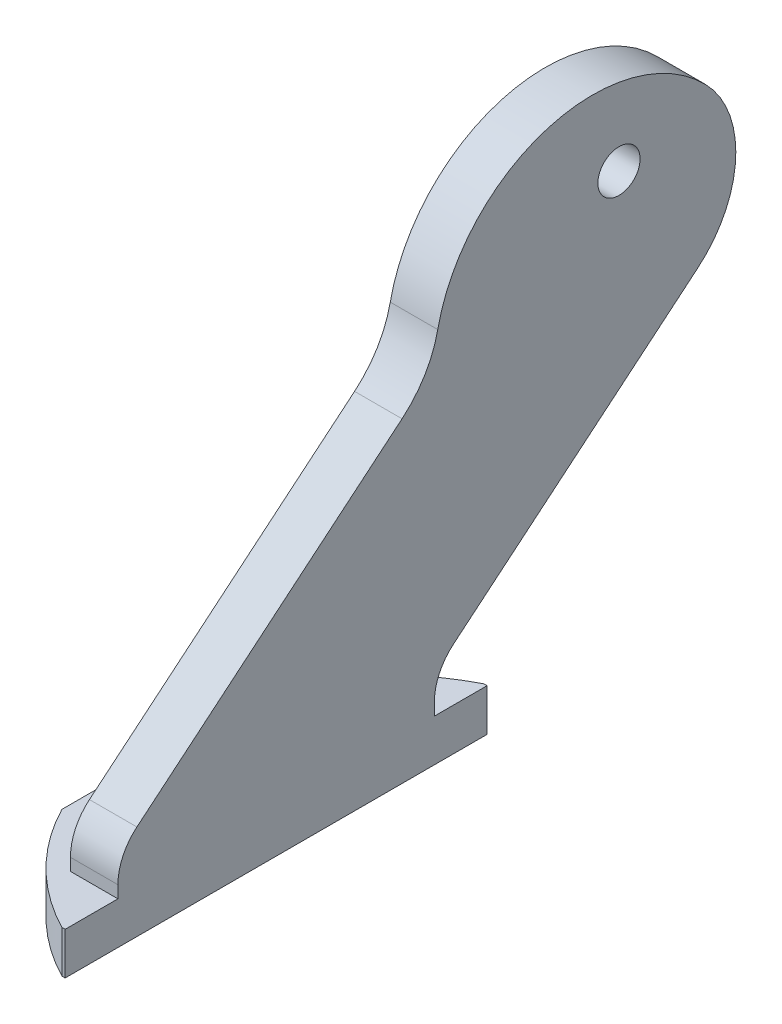
from build123d import *

# Parameters (mm, degrees)
CROQUIS1_W              = 20
CROQUIS1_H              = 80
SALIENTE_EXTRUIR2_DEPTH = 8
CORTAR_EXTRUIR1_DEPTH   = 8
CROQUIS4_R              = 4
SALIENTE_EXTRUIR3_DEPTH = 13
CROQUIS5_W              = 11
CROQUIS5_H              = 133.76595163
CORTAR_EXTRUIR2_DEPTH   = 87
CROQUIS6_R              = 1.6
CORTAR_EXTRUIR3_DEPTH   = 87
CROQUIS7_R              = 3.25
CORTAR_EXTRUIR4_DEPTH   = 3


with BuildPart() as part:
    # Croquis1 → Saliente-Extruir2 (new body)
    with BuildSketch(Plane(origin=(0, 0, 0), x_dir=(1, 0, 0), z_dir=(0, 1, 0))):
        with Locations((-10, 0)):
            Rectangle(CROQUIS1_W, CROQUIS1_H)
    extrude(amount=SALIENTE_EXTRUIR2_DEPTH)

    # Croquis2 → Cortar-Extruir1 (cut)
    with BuildSketch(Plane(origin=(0, 8, 0), x_dir=(1, 0, 0), z_dir=(0, 1, 0))):
        with BuildLine():
            ThreePointArc((-0.615528128, -40), (-11.819805153, -31.819805153), (-20, -20.615528128))
            Line((-20, -20.615528128), (-20, -40))
            Line((-20, -40), (-0.615528128, -40))
        make_face()
        with BuildLine():
            Line((-0.615528128, 40), (-20, 40))
            Line((-20, 40), (-20, 20.615528128))
            ThreePointArc((-20, 20.615528128), (-11.819805153, 31.819805153), (-0.615528128, 40))
        make_face()
    extrude(amount=-CORTAR_EXTRUIR1_DEPTH, mode=Mode.SUBTRACT)

    # Croquis4 → Saliente-Extruir3 (add)
    with BuildSketch(Plane(origin=(0, 0, 0), x_dir=(0, 0, -1), z_dir=(1, 0, 0))):
        with BuildLine():
            Line((0, 0), (30, 0))
            Line((30, 0), (30, 10.31625054))
            ThreePointArc((30, 10.31625054), (30.944105788, 14.557804503), (33.598156003, 17.998463336))
            Line((33.598156003, 17.998463336), (79.953012113, 56.627510094))
            ThreePointArc((79.953012113, 56.627510094), (87.123427128, 70.974483465), (81.447972358, 85.975807058))
            ThreePointArc((81.447972358, 85.975807058), (51.597737237, 93.799339931), (30.637508796, 71.151756681))
            ThreePointArc((30.637508796, 71.151756681), (28.203401142, 64.948074064), (23.866202653, 59.88850221))
            Line((23.866202653, 59.88850221), (-26.401843997, 17.998463336))
            ThreePointArc((-26.401843997, 17.998463336), (-29.055894212, 14.557804503), (-30, 10.31625054))
            Line((-30, 10.31625054), (-30, 0))
            Line((-30, 0), (0, 0))
        make_face()
        with Locations((65, 80)):
            Circle(CROQUIS4_R, mode=Mode.SUBTRACT)
    extrude(amount=-SALIENTE_EXTRUIR3_DEPTH)

    # Croquis5 → Cortar-Extruir2 (cut)
    with BuildSketch(Plane(origin=(0, 95, 0), x_dir=(1, 0, 0), z_dir=(0, 1, 0))):
        with Locations((-14.5, 20.266348304)):
            Rectangle(CROQUIS5_W, CROQUIS5_H)
    extrude(amount=-CORTAR_EXTRUIR2_DEPTH, mode=Mode.SUBTRACT)

    # Croquis6 → Cortar-Extruir3 (cut)
    with BuildSketch(Plane(origin=(0, 8, 0), x_dir=(1, 0, 0), z_dir=(0, 1, 0))):
        with Locations(Location((-14.5, 14.446020213, 0), (0, 0, 270))):
            Circle(CROQUIS6_R)
        with Locations(Location((-14.5, 0, 0), (0, 0, 270))):
            Circle(CROQUIS6_R)
        with Locations(Location((-14.5, -14.446020213, 0), (0, 0, 270))):
            Circle(CROQUIS6_R)
    extrude(amount=-CORTAR_EXTRUIR3_DEPTH, mode=Mode.SUBTRACT)

    # Croquis7 → Cortar-Extruir4 (cut)
    with BuildSketch(Plane(origin=(0, 8, 0), x_dir=(1, 0, 0), z_dir=(0, 1, 0))):
        with Locations(Location((-14.5, 14.446020213, 0), (0, 0, 270))):
            Circle(CROQUIS7_R)
        with Locations(Location((-14.5, 0, 0), (0, 0, 270))):
            Circle(CROQUIS7_R)
        with Locations(Location((-14.5, -14.446020213, 0), (0, 0, 270))):
            Circle(CROQUIS7_R)
    extrude(amount=-CORTAR_EXTRUIR4_DEPTH, mode=Mode.SUBTRACT)


solid = part.part
